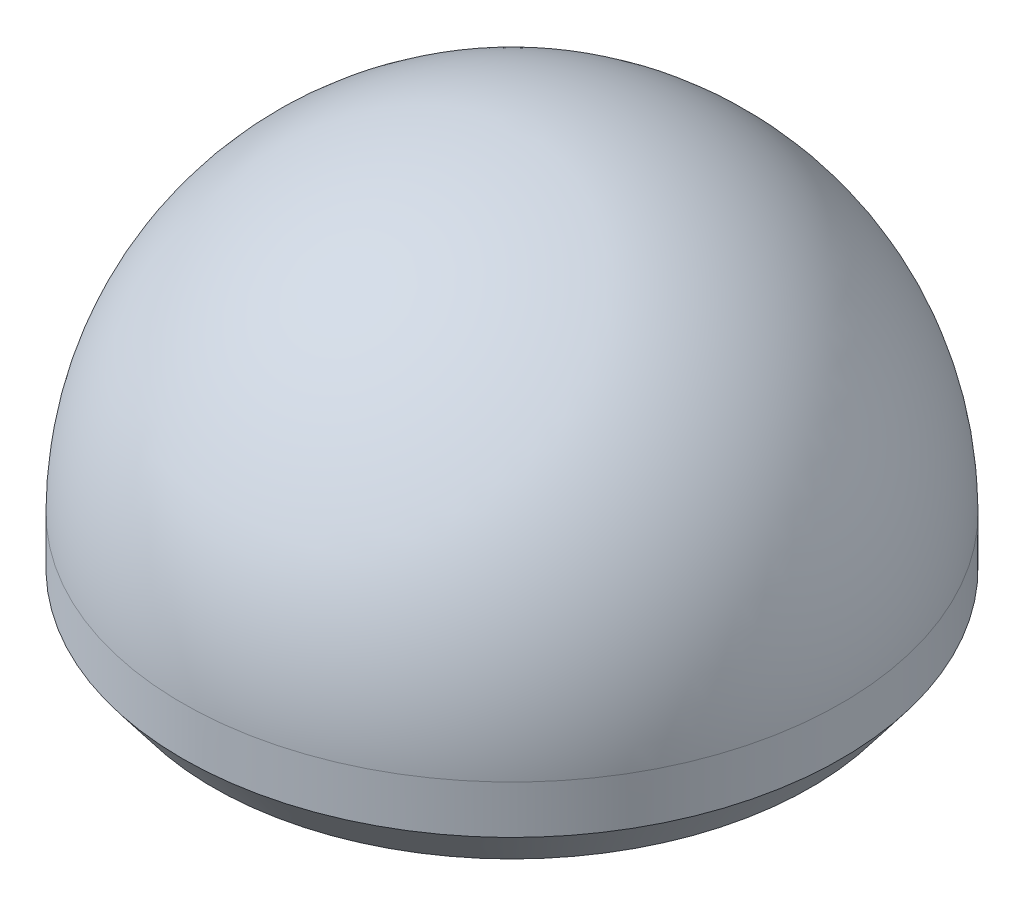
from build123d import *

# Parameters (mm, degrees)
CIRPATTERN2_COUNT = 4


with BuildPart() as part:
    # Sketch1 → Revolve1 (revolve)
    with BuildSketch(Plane.XY):
        with BuildLine():
            Line((-150, 0), (-150, -21.839688718))
            Line((-150, -21.839688718), (-135.992561225, -40.2238734))
            ThreePointArc((-135.992561225, -40.2238734), (-70.908280017, -10.266781974), (0, 0))
            Line((0, 0), (0, 150))
            ThreePointArc((0, 150), (-106.066017178, 106.066017178), (-150, 0))
        make_face()
    revolve(axis=Axis((0, 0, 0), (0, 1, 0)))

    # Sketch2 → Cut-Revolve2 (revolve, cut)
    with BuildSketch(Plane.XY):
        with BuildLine():
            Line((88.925237265, -25.679918596), (88.925237265, 14.320081404))
            ThreePointArc((88.925237265, 14.320081404), (108.925237265, -5.679918596), (88.925237265, -25.679918596))
        make_face()
    cut_revolve2 = revolve(axis=Axis((88.925237265, -25.679918596, 0), (0, 1, 0)), mode=Mode.SUBTRACT)

    # CirPattern2: Cut-Revolve2 ×4 about axis
    cirpattern2_axis = Axis((0, 0, 0), (0, 1, 0))
    for i in range(1, CIRPATTERN2_COUNT):
        add(cut_revolve2.rotate(cirpattern2_axis, i * 360 / CIRPATTERN2_COUNT), mode=Mode.SUBTRACT)


solid = part.part
